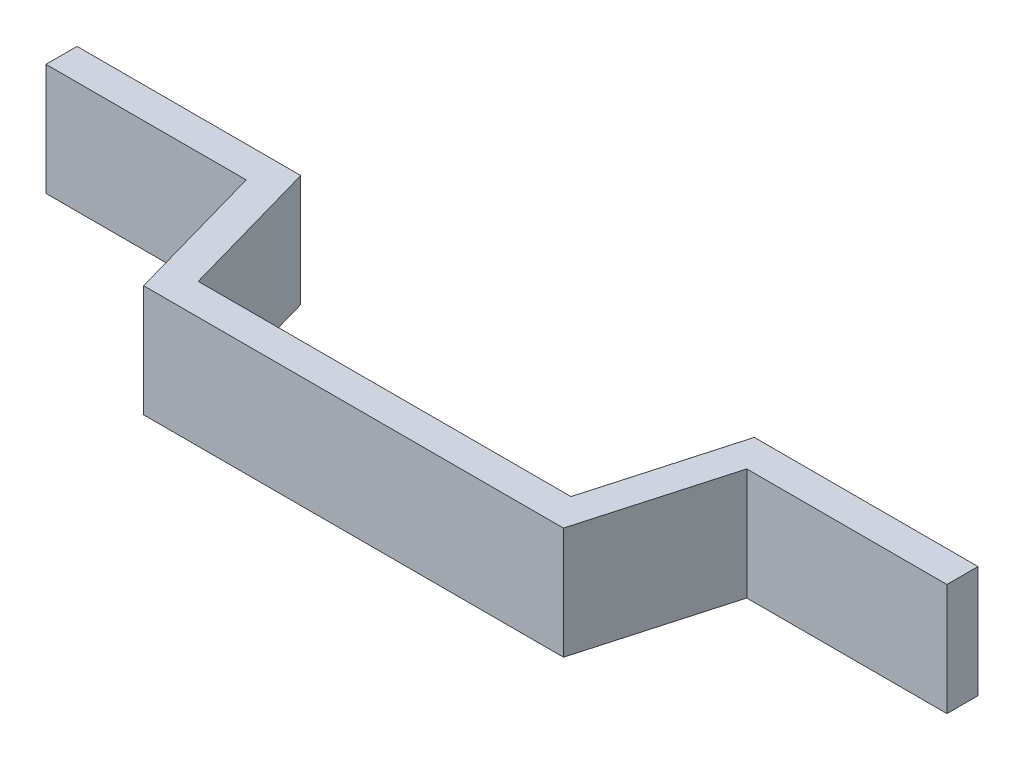
from build123d import *

# Parameters (mm, degrees)
EXTRUDE_1_DEPTH = 18


with BuildPart() as part:
    # 草图1 → 凸台-拉伸1 (new body)
    with BuildSketch(Plane(origin=(0, 0, 0), x_dir=(1, 0, 0), z_dir=(0, 1, 0))):
        Polygon((-72.5, 28), (-36.5, 28), (-30, 5), (30, 5), (36.5, 28), (72.5, 28), (72.5, 23), (40.28279061, 23), (33.78279061, 0), (-33.78279061, 0), (-40.28279061, 23), (-72.5, 23), align=None)
    extrude(amount=EXTRUDE_1_DEPTH)


solid = part.part
